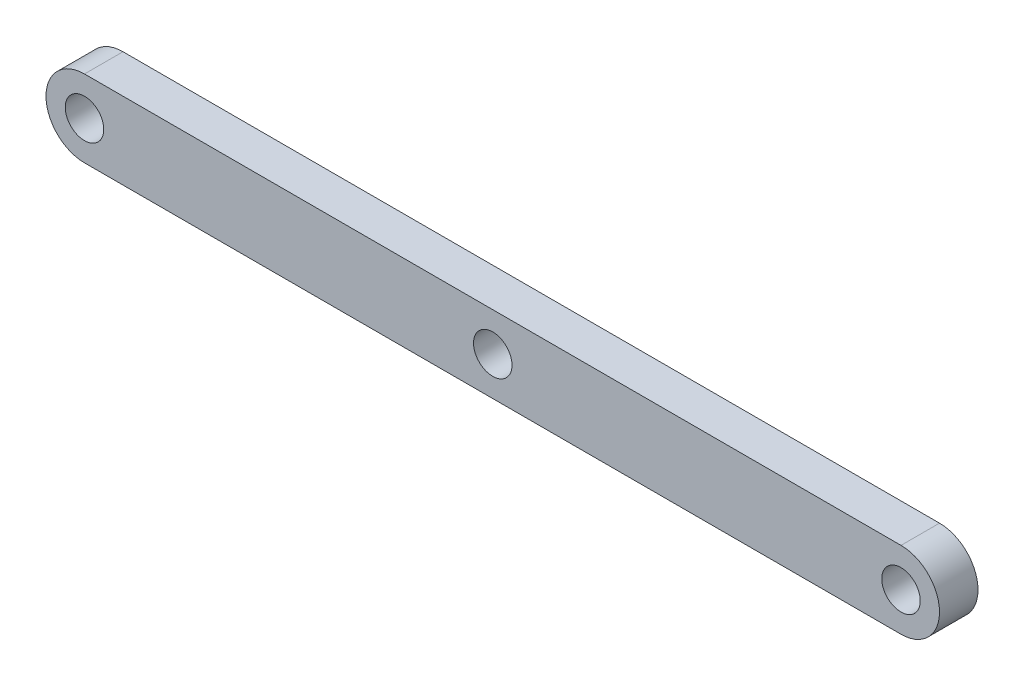
from build123d import *

# Parameters (mm, degrees)
SKETCH_1_R      = 1
EXTRUDE_1_DEPTH = 2


with BuildPart() as part:
    # 草圖1 → 填料-伸長1 (new body)
    with BuildSketch(Plane.XY):
        with BuildLine():
            Line((-21.209999972, 2.001094383), (21.210000028, 2.001094383))
            ThreePointArc((21.210000028, 2.001094383), (23.210000028, 0.001094383), (21.210000028, -1.998905617))
            Line((21.210000028, -1.998905617), (-21.209999972, -1.998905617))
            ThreePointArc((-21.209999972, -1.998905617), (-23.209999972, 0.001094383), (-21.209999972, 2.001094383))
        make_face()
        with Locations((-21.209999972, 0.001094383)):
            Circle(SKETCH_1_R, mode=Mode.SUBTRACT)
        with Locations((21.210000028, 0.001094383)):
            Circle(SKETCH_1_R, mode=Mode.SUBTRACT)
        Circle(SKETCH_1_R, mode=Mode.SUBTRACT)
    extrude(amount=EXTRUDE_1_DEPTH)


solid = part.part
